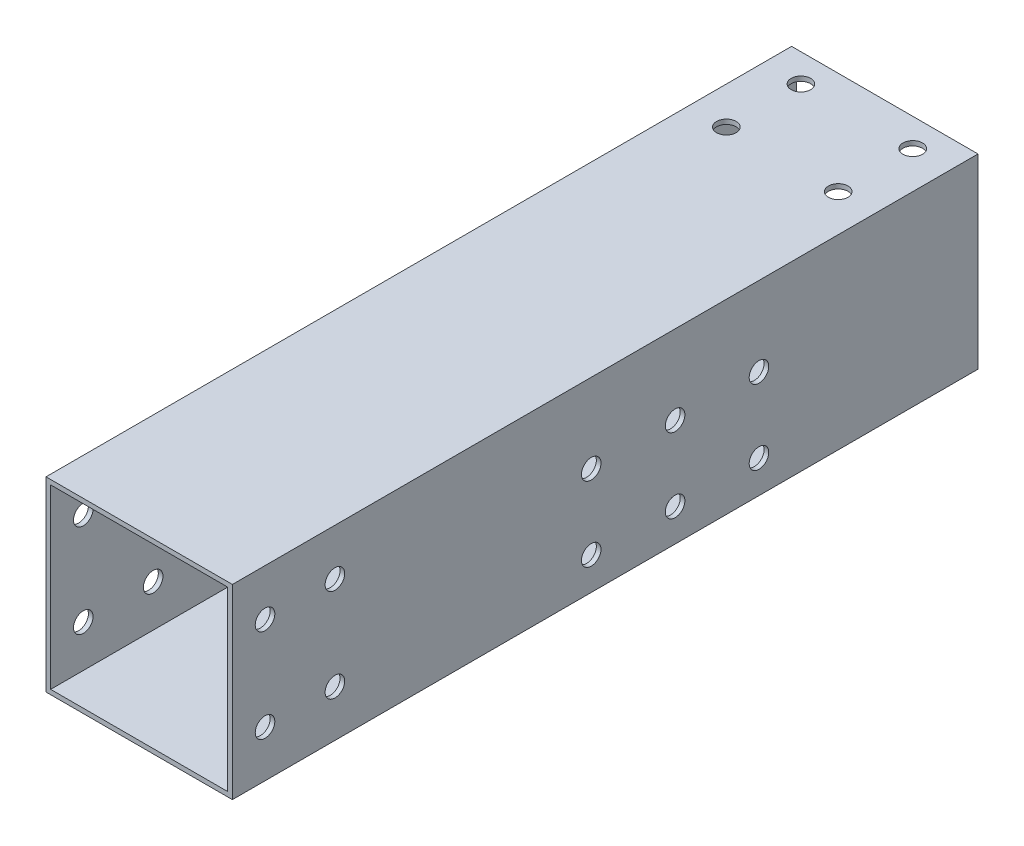
from build123d import *

# Parameters (mm, degrees)
SKETCH_1_W          = 40
SKETCH_1_H          = 40
SKETCH_1_W_2        = 38
SKETCH_1_H_2        = 38
EXTRUDE_1_DEPTH     = 160
SKETCH_2_R          = 2.1
CUT_EXTRUDE_1_DEPTH = 170.705627485
SKETCH_4_R          = 2.1
CUT_EXTRUDE_2_DEPTH = 170.705627485


with BuildPart() as part:
    # 草图1 → 凸台-拉伸1 (new body)
    with BuildSketch(Plane.XY):
        with Locations((20, 20)):
            Rectangle(SKETCH_1_W, SKETCH_1_H)
        with Locations((20, 20)):
            Rectangle(SKETCH_1_W_2, SKETCH_1_H_2, mode=Mode.SUBTRACT)
    extrude(amount=EXTRUDE_1_DEPTH)

    # 草图2 → 切除-拉伸1 (cut, through all)
    with BuildSketch(Plane.XZ):
        with Locations(Location((8, 6, 0), (0, 0, 270))):
            Circle(SKETCH_2_R)
        with Locations(Location((32, 22, 0), (0, 0, 270))):
            Circle(SKETCH_2_R)
        with Locations(Location((8, 22, 0), (0, 0, 270))):
            Circle(SKETCH_2_R)
        with Locations(Location((32, 6, 0), (0, 0, 270))):
            Circle(SKETCH_2_R)
    extrude(amount=-CUT_EXTRUDE_1_DEPTH, mode=Mode.SUBTRACT)

    # 草图4 → 切除-拉伸2 (cut, through all)
    with BuildSketch(Plane.ZY):
        with Locations((138, 10)):
            Circle(SKETCH_4_R)
        with Locations((153, 30)):
            Circle(SKETCH_4_R)
        with Locations((153, 10)):
            Circle(SKETCH_4_R)
        with Locations((138, 30)):
            Circle(SKETCH_4_R)
        with Locations((83, 23)):
            Circle(SKETCH_4_R)
        with Locations((65, 7)):
            Circle(SKETCH_4_R)
        with Locations((65, 23)):
            Circle(SKETCH_4_R)
        with Locations((47, 7)):
            Circle(SKETCH_4_R)
        with Locations((47, 23)):
            Circle(SKETCH_4_R)
        with Locations((83, 7)):
            Circle(SKETCH_4_R)
    extrude(amount=-CUT_EXTRUDE_2_DEPTH, mode=Mode.SUBTRACT)


solid = part.part
